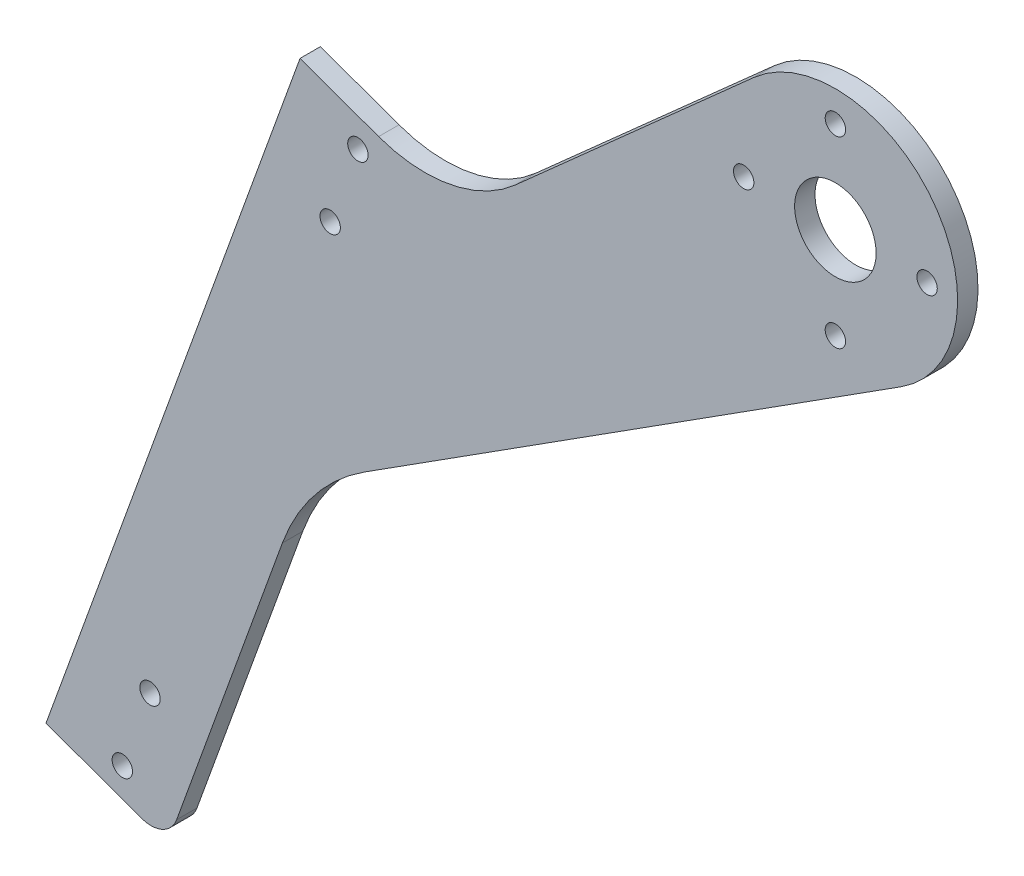
from build123d import *

# Parameters (mm, degrees)
MODEL_R         = 1.5
MODEL_R_2       = 6
EXTRUDE_1_DEPTH = 3


with BuildPart() as part:
    # Model → 凸台-拉伸1 (new body)
    with BuildSketch(Plane.XY):
        with BuildLine():
            Line((2489.401518441, 1758.026761836), (2477.832923788, 1762.20884815))
            Line((2477.832923788, 1762.20884815), (2447.235551014, 1677.569609145))
            Line((2447.235551014, 1677.569609145), (2443.835842928, 1668.165249256))
            Line((2443.835842928, 1668.165249256), (2440.436134842, 1658.760889367))
            Line((2440.436134842, 1658.760889367), (2441.846788825, 1658.250933154))
            Line((2441.846788825, 1658.250933154), (2446.54896877, 1656.551079111))
            Line((2446.54896877, 1656.551079111), (2453.602238687, 1654.001298046))
            Line((2453.602238687, 1654.001298046), (2454.542674676, 1653.661327237))
            ThreePointArc((2454.542674676, 1653.661327237), (2457.600929914, 1653.801533876), (2459.664301866, 1656.063187959))
            Line((2459.664301866, 1656.063187959), (2465.103834804, 1671.110163782))
            Line((2465.103834804, 1671.110163782), (2466.691626019, 1675.502352652))
            Line((2466.691626019, 1675.502352652), (2475.230094166, 1699.121682704))
            ThreePointArc((2475.230094166, 1699.121682704), (2480.022947289, 1707.670704716), (2487.315446875, 1714.218732526))
            Line((2487.315446875, 1714.218732526), (2566.313045726, 1764.584123777))
            ThreePointArc((2566.313045726, 1764.584123777), (2570.993188824, 1790.619216903), (2544.66757117, 1793.206042885))
            Line((2544.66757117, 1793.206042885), (2509.499643925, 1761.897465327))
            ThreePointArc((2509.499643925, 1761.897465327), (2499.983234073, 1757.196382583), (2489.401518441, 1758.026761836))
        make_face()
        with Locations((2451.67059596, 1658.952939832)):
            Circle(MODEL_R, mode=Mode.SUBTRACT)
        with Locations((2455.750245663, 1670.238171699)):
            Circle(MODEL_R, mode=Mode.SUBTRACT)
        with Locations((2482.267968734, 1743.592178837)):
            Circle(MODEL_R, mode=Mode.SUBTRACT)
        with Locations((2486.347618438, 1754.877410704)):
            Circle(MODEL_R, mode=Mode.SUBTRACT)
        with Locations((2556.636409551, 1766.261828225)):
            Circle(MODEL_R, mode=Mode.SUBTRACT)
        with Locations((2543.136409551, 1779.761828225)):
            Circle(MODEL_R, mode=Mode.SUBTRACT)
        with Locations((2556.636409551, 1779.761828225)):
            Circle(MODEL_R_2, mode=Mode.SUBTRACT)
        with Locations((2556.636409551, 1793.261828225)):
            Circle(MODEL_R, mode=Mode.SUBTRACT)
        with Locations((2570.136409551, 1779.761828225)):
            Circle(MODEL_R, mode=Mode.SUBTRACT)
    extrude(amount=EXTRUDE_1_DEPTH)


solid = part.part
